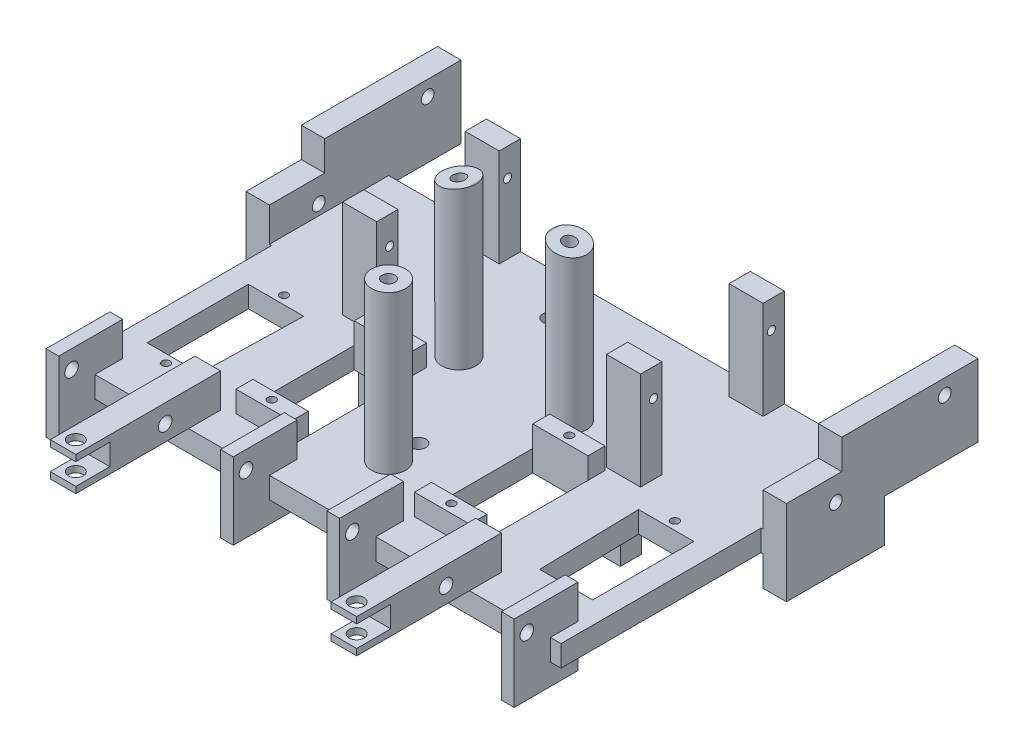
from build123d import *

# Parameters (mm, degrees)
SKETCH_1_W           = 115
SKETCH_1_H           = 75
EXTRUDE_1_DEPTH      = 5
SKETCH_4_W           = 116
SKETCH_4_H           = 28
EXTRUDE_4_DEPTH      = 5
SKETCH_5_W           = 23
SKETCH_5_H           = 20
EXTRUDE_5_DEPTH      = 5.5
SKETCH_6_W           = 32
SKETCH_6_H           = 17
EXTRUDE_6_DEPTH      = 5.5
SKETCH_8_W           = 8
SKETCH_8_H           = 5
EXTRUDE_7_DEPTH      = 23
EXTRUDE_START        = -10
SKETCH_9_W           = 3
SKETCH_9_H           = 15
EXTRUDE_8_DEPTH      = 18
SKETCH_10_W          = 3
SKETCH_10_H          = 15
EXTRUDE_9_DEPTH      = 18
SKETCH_11_W          = 6
SKETCH_11_H          = 34
EXTRUDE_10_DEPTH     = 8
SKETCH_12_R          = 4
EXTRUDE_11_DEPTH     = 37
CUT_EXTRUDE_8_REACH  = 122.453
SKETCH_19_R          = 0.95
SKETCH_25_R          = 4
EXTRUDE_14_DEPTH     = 37
CUT_EXTRUDE_14_DEPTH = 36
SKETCH_28_W          = 6
SKETCH_28_H          = 5
CUT_EXTRUDE_16_DEPTH = 8
SKETCH_29_R          = 1.75
CUT_EXTRUDE_17_DEPTH = 8
SKETCH_30_R          = 1.6
CUT_EXTRUDE_18_DEPTH = 48
SKETCH_31_R          = 1.75
CUT_EXTRUDE_19_DEPTH = 20
SKETCH_35_R          = 1.5
CUT_EXTRUDE_23_DEPTH = 15
SKETCH_36_R          = 0.95
SKETCH_36_W          = 13
SKETCH_36_H          = 23.8
CUT_EXTRUDE_24_DEPTH = 7
SKETCH_37_W          = 6
SKETCH_37_H          = 5
SKETCH_37_W_2        = 5.306431403
EXTRUDE_15_DEPTH     = 13
SKETCH_38_R          = 0.95
CUT_EXTRUDE_25_DEPTH = 13
SKETCH_43_W          = 37.306431403
SKETCH_43_H          = 36.317543969
SKETCH_43_W_2        = 5.306431403
SKETCH_43_H_2        = 5
SKETCH_43_W_3        = 6
CUT_EXTRUDE_28_DEPTH = 2
EXTRUDE_START_2      = 5
SKETCH_41_W          = 13
SKETCH_41_H          = 4
SKETCH_41_R          = 0.95
EXTRUDE_16_DEPTH     = 5
CUT_EXTRUDE_START    = -13
SKETCH_39_R          = 1.5
CUT_EXTRUDE_26_DEPTH = 55


with BuildPart() as part:
    # 草图1 → 凸台-拉伸1 (new body)
    with BuildSketch(Plane(origin=(0, 0, 0), x_dir=(1, 0, 0), z_dir=(0, 1, 0))):
        Rectangle(SKETCH_1_W, SKETCH_1_H)
    extrude(amount=EXTRUDE_1_DEPTH)

    # 草图4 → 凸台-拉伸4 (add)
    with BuildSketch(Plane(origin=(0, 5, 0), x_dir=(1, 0, 0), z_dir=(0, 1, 0))):
        with Locations((0, 23.5)):
            Rectangle(SKETCH_4_W, SKETCH_4_H)
    extrude(amount=-EXTRUDE_4_DEPTH)

    # 草图5 → 凸台-拉伸5 (add)
    with BuildSketch(Plane.ZY.offset(58)):
        with Locations((-21, 3)):
            Rectangle(SKETCH_5_W, SKETCH_5_H)
    extrude_5 = extrude(amount=EXTRUDE_5_DEPTH)

    # 草图6 → 凸台-拉伸6 (add)
    with BuildSketch(Plane.ZY.offset(58)):
        with Locations((-38.5, 11.5)):
            Rectangle(SKETCH_6_W, SKETCH_6_H)
    extrude_6 = extrude(amount=EXTRUDE_6_DEPTH)

    # 草图8 → 凸台-拉伸7 (add)
    with BuildSketch(Plane(origin=(0, 5, 0), x_dir=(1, 0, 0), z_dir=(0, 1, 0))):
        with Locations((-31, 35)):
            Rectangle(SKETCH_8_W, SKETCH_8_H)
        with Locations((-31, 6.2)):
            Rectangle(SKETCH_8_W, SKETCH_8_H)
    extrude_7 = extrude(amount=EXTRUDE_7_DEPTH)

    # 草图9 → 凸台-拉伸8 (add)
    with BuildSketch(Plane(origin=(0, 5, 0), x_dir=(1, 0, 0), z_dir=(0, 1, 0)).offset(EXTRUDE_START)):
        with Locations((-12.5, -38.5)):
            Rectangle(SKETCH_9_W, SKETCH_9_H)
    extrude_8 = extrude(amount=EXTRUDE_8_DEPTH)

    # 草图10 → 凸台-拉伸9 (add)
    with BuildSketch(Plane(origin=(0, 5, 0), x_dir=(1, 0, 0), z_dir=(0, 1, 0)).offset(EXTRUDE_START)):
        with Locations((-53.5, -38.5)):
            Rectangle(SKETCH_10_W, SKETCH_10_H)
    extrude_9 = extrude(amount=EXTRUDE_9_DEPTH)

    # 草图11 → 凸台-拉伸10 (add)
    with BuildSketch(Plane(origin=(0, 5, 0), x_dir=(1, 0, 0), z_dir=(0, 1, 0))):
        with Locations((-33, -47)):
            Rectangle(SKETCH_11_W, SKETCH_11_H)
    extrude_10 = extrude(amount=EXTRUDE_10_DEPTH)

    # 草图12 → 凸台-拉伸11 (add)
    with BuildSketch(Plane(origin=(0, 5, 0), x_dir=(1, 0, 0), z_dir=(0, 1, 0))):
        with Locations(Location((-13, 9, 0), (0, 0, 270))):
            Circle(SKETCH_12_R)
    extrude_11 = extrude(amount=EXTRUDE_11_DEPTH)

    # 草图19 → 切除-拉伸8 (cut, up to next)
    with BuildSketch(Plane.ZY.offset(35), mode=Mode.PRIVATE) as cut_extrude_8_sk1:
        with Locations((-6.75, 21.5)):
            Circle(SKETCH_19_R)
    cut_extrude_8_tool1 = extrude(cut_extrude_8_sk1.sketch, amount=-CUT_EXTRUDE_8_REACH, mode=Mode.PRIVATE) & part.part
    # 草图19 → 切除-拉伸8 (cut, up to next)
    with BuildSketch(Plane.ZY.offset(35), mode=Mode.PRIVATE) as cut_extrude_8_sk2:
        with Locations((-34.45, 21.5)):
            Circle(SKETCH_19_R)
    cut_extrude_8_tool2 = extrude(cut_extrude_8_sk2.sketch, amount=-CUT_EXTRUDE_8_REACH, mode=Mode.PRIVATE) & part.part
    cut_extrude_8_1 = cut_extrude_8_tool1.solids().sort_by_distance((-35, 21.5, -6.75))[0]
    add(cut_extrude_8_1, mode=Mode.SUBTRACT)
    cut_extrude_8_2 = cut_extrude_8_tool2.solids().sort_by_distance((-35, 21.5, -34.45))[0]
    add(cut_extrude_8_2, mode=Mode.SUBTRACT)
    cut_extrude_8 = cut_extrude_8_1 + cut_extrude_8_2  # 切除-拉伸8 as one shape, for the pattern or mirror that repeats it

    # 草图25 → 凸台-拉伸14 (add)
    with BuildSketch(Plane(origin=(0, 5, 0), x_dir=(1, 0, 0), z_dir=(0, 1, 0))):
        with Locations(Location((0, -20.5, 0), (0, 0, 270))):
            Circle(SKETCH_25_R)
    extrude_14 = extrude(amount=EXTRUDE_14_DEPTH)

    # 草图26 → 切除-拉伸14 (cut)
    with BuildSketch(Plane.XY):
        Polygon((-17, 42), (-17, 40.644045518), (-9.31, 42), align=None)
    cut_extrude_14 = extrude(amount=-CUT_EXTRUDE_14_DEPTH, mode=Mode.SUBTRACT)

    # 草图28 → 切除-拉伸16 (cut)
    with BuildSketch(Plane.XY.offset(64)):
        with Locations((-33, 9)):
            Rectangle(SKETCH_28_W, SKETCH_28_H)
    cut_extrude_16 = extrude(amount=-CUT_EXTRUDE_16_DEPTH, mode=Mode.SUBTRACT)

    # 草图29 → 切除-拉伸17 (cut)
    with BuildSketch(Plane(origin=(0, 13, 0), x_dir=(1, 0, 0), z_dir=(0, 1, 0))):
        with Locations(Location((-33, -61, 0), (0, 0, 270))):
            Circle(SKETCH_29_R)
    cut_extrude_17 = extrude(amount=-CUT_EXTRUDE_17_DEPTH, mode=Mode.SUBTRACT)

    # 草图30 → 切除-拉伸18 (cut)
    with BuildSketch(Plane.ZY.offset(55)):
        with Locations((43, 8.75)):
            Circle(SKETCH_30_R)
    cut_extrude_18 = extrude(amount=-CUT_EXTRUDE_18_DEPTH, mode=Mode.SUBTRACT)

    # 草图31 → 切除-拉伸19 (cut)
    with BuildSketch(Plane(origin=(0, 5, 0), x_dir=(1, 0, 0), z_dir=(0, 1, 0))):
        with Locations(Location((0, -13.5, 0), (0, 0, 270))):
            Circle(SKETCH_31_R)
        with Locations(Location((-10, 27.5, 0), (0, 0, 270))):
            Circle(SKETCH_31_R)
        with Locations(Location((10, 27.5, 0), (0, 0, 270))):
            Circle(SKETCH_31_R)
    cut_extrude_19 = extrude(amount=-CUT_EXTRUDE_19_DEPTH, mode=Mode.SUBTRACT)

    # 草图35 → 切除-拉伸23 (cut)
    with BuildSketch(Plane.ZY.offset(63.5)):
        with Locations((-46.688415906, 16.452713274)):
            Circle(SKETCH_35_R)
        with Locations((-21.089366767, 7.437765567)):
            Circle(SKETCH_35_R)
    cut_extrude_23 = extrude(amount=-CUT_EXTRUDE_23_DEPTH, mode=Mode.SUBTRACT)

    # 草图36 → 切除-拉伸24 (cut)
    with BuildSketch(Plane(origin=(0, 5, 0), x_dir=(1, 0, 0), z_dir=(0, 1, 0))):
        with Locations(Location((-21.107931352, 0.851498958, 0), (0, 0, 270))):
            Circle(SKETCH_36_R)
        with Locations(Location((-21.107931352, -26.848501042, 0), (0, 0, 270))):
            Circle(SKETCH_36_R)
        with Locations(Location((-45.971767543, -26.848501042, 0), (0, 0, 270))):
            Circle(SKETCH_36_R)
        with Locations(Location((-45.922700168, 0.851498958, 0), (0, 0, 270))):
            Circle(SKETCH_36_R)
        with Locations((-20.972977651, -12.998501042)):
            Rectangle(SKETCH_36_W, SKETCH_36_H)
        Polygon((-39.336811012, -1.098501042), (-39.899021853, -24.898501042), (-52.336811012, -24.898501042), (-52.336811012, -1.098501042), align=None)
    cut_extrude_24 = extrude(amount=-CUT_EXTRUDE_24_DEPTH, mode=Mode.SUBTRACT)

    # 草图37 → 凸台-拉伸15 (add)
    with BuildSketch(Plane.XZ):
        with Locations((-28.466349778, -34.482456031)):
            Rectangle(SKETCH_37_W, SKETCH_37_H)
        with Locations((-28.11956548, -5.682456031)):
            Rectangle(SKETCH_37_W_2, SKETCH_37_H)
    extrude_15 = extrude(amount=EXTRUDE_15_DEPTH)

    # 草图38 → 切除-拉伸25 (cut)
    with BuildSketch(Plane.ZY.offset(31.466349778)):
        with Locations((-33.932456031, -4.5)):
            Circle(SKETCH_38_R)
        with Locations((-6.232456031, -4.5)):
            Circle(SKETCH_38_R)
    cut_extrude_25 = extrude(amount=-CUT_EXTRUDE_25_DEPTH, mode=Mode.SUBTRACT)

    # 草图43 → 切除-拉伸28 (cut)
    with BuildSketch(Plane.XZ):
        with Locations((-36.11956548, -19.341228016)):
            Rectangle(SKETCH_43_W, SKETCH_43_H)
        with Locations((-28.11956548, -5.682456031)):
            Rectangle(SKETCH_43_W_2, SKETCH_43_H_2, mode=Mode.SUBTRACT)
        with Locations((-28.466349778, -34.482456031)):
            Rectangle(SKETCH_43_W_3, SKETCH_43_H_2, mode=Mode.SUBTRACT)
    cut_extrude_28 = extrude(amount=-CUT_EXTRUDE_28_DEPTH, mode=Mode.SUBTRACT)

    # 草图41 → 凸台-拉伸16 (add)
    # profile 1 of 2: a face of its own
    with BuildSketch(Plane(origin=(0, 5, 0), x_dir=(1, 0, 0), z_dir=(0, 1, 0)).offset(EXTRUDE_START_2)):
        with Locations((-20.972977651, 0.901498958)):
            Rectangle(SKETCH_41_W, SKETCH_41_H)
        with Locations(Location((-21.107931352, 0.851498958, 0), (0, 0, 270))):
            Circle(SKETCH_41_R, mode=Mode.SUBTRACT)
    # profile 2 of 2: a face of its own
    with BuildSketch(Plane(origin=(0, 5, 0), x_dir=(1, 0, 0), z_dir=(0, 1, 0)).offset(EXTRUDE_START_2)):
        with Locations((-20.972977651, -26.898501042)):
            Rectangle(SKETCH_41_W, SKETCH_41_H)
        with Locations(Location((-21.107931352, -26.848501042, 0), (0, 0, 270))):
            Circle(SKETCH_41_R, mode=Mode.SUBTRACT)
    extrude_16 = extrude(amount=-EXTRUDE_16_DEPTH)

    # 草图39 → 切除-拉伸26 (cut)
    with BuildSketch(Plane(origin=(0, 5, 0), x_dir=(1, 0, 0), z_dir=(0, 1, 0)).offset(CUT_EXTRUDE_START)):
        with Locations(Location((-13, 9, 0), (0, 0, 180))):
            Circle(SKETCH_39_R)
        with Locations(Location((0, -20.5, 0), (0, 0, 270))):
            Circle(SKETCH_39_R)
    cut_extrude_26 = extrude(amount=CUT_EXTRUDE_26_DEPTH, mode=Mode.SUBTRACT)

    # 镜向1: 凸台-拉伸5, 凸台-拉伸6, 凸台-拉伸7, 凸台-拉伸8, 凸台-拉伸9, 凸台-拉伸10, 凸台-拉伸11, 切除-拉伸8, 凸台-拉伸14, 切除-拉伸14, 切除-拉伸16, 切除-拉伸17, 切除-拉伸18, 切除-拉伸19, 切除-拉伸23, 切除-拉伸24, 凸台-拉伸15, 切除-拉伸25, 切除-拉伸28, 凸台-拉伸16, 切除-拉伸26 across plane
    add(extrude_5.mirror(Plane(origin=(0, 0, 0), x_dir=(0, 0, 1), z_dir=(1, 0, 0))))
    add(extrude_6.mirror(Plane(origin=(0, 0, 0), x_dir=(0, 0, 1), z_dir=(1, 0, 0))))
    add(extrude_7.mirror(Plane(origin=(0, 0, 0), x_dir=(0, 0, 1), z_dir=(1, 0, 0))))
    add(extrude_8.mirror(Plane(origin=(0, 0, 0), x_dir=(0, 0, 1), z_dir=(1, 0, 0))))
    add(extrude_9.mirror(Plane(origin=(0, 0, 0), x_dir=(0, 0, 1), z_dir=(1, 0, 0))))
    add(extrude_10.mirror(Plane(origin=(0, 0, 0), x_dir=(0, 0, 1), z_dir=(1, 0, 0))))
    add(extrude_11.mirror(Plane(origin=(0, 0, 0), x_dir=(0, 0, 1), z_dir=(1, 0, 0))))
    add(cut_extrude_8.mirror(Plane(origin=(0, 0, 0), x_dir=(0, 0, 1), z_dir=(1, 0, 0))), mode=Mode.SUBTRACT)
    add(extrude_14.mirror(Plane(origin=(0, 0, 0), x_dir=(0, 0, 1), z_dir=(1, 0, 0))))
    add(cut_extrude_14.mirror(Plane(origin=(0, 0, 0), x_dir=(0, 0, 1), z_dir=(1, 0, 0))), mode=Mode.SUBTRACT)
    add(cut_extrude_16.mirror(Plane(origin=(0, 0, 0), x_dir=(0, 0, 1), z_dir=(1, 0, 0))), mode=Mode.SUBTRACT)
    add(cut_extrude_17.mirror(Plane(origin=(0, 0, 0), x_dir=(0, 0, 1), z_dir=(1, 0, 0))), mode=Mode.SUBTRACT)
    add(cut_extrude_18.mirror(Plane(origin=(0, 0, 0), x_dir=(0, 0, 1), z_dir=(1, 0, 0))), mode=Mode.SUBTRACT)
    add(cut_extrude_19.mirror(Plane(origin=(0, 0, 0), x_dir=(0, 0, 1), z_dir=(1, 0, 0))), mode=Mode.SUBTRACT)
    add(cut_extrude_23.mirror(Plane(origin=(0, 0, 0), x_dir=(0, 0, 1), z_dir=(1, 0, 0))), mode=Mode.SUBTRACT)
    add(cut_extrude_24.mirror(Plane(origin=(0, 0, 0), x_dir=(0, 0, 1), z_dir=(1, 0, 0))), mode=Mode.SUBTRACT)
    add(extrude_15.mirror(Plane(origin=(0, 0, 0), x_dir=(0, 0, 1), z_dir=(1, 0, 0))))
    add(cut_extrude_25.mirror(Plane(origin=(0, 0, 0), x_dir=(0, 0, 1), z_dir=(1, 0, 0))), mode=Mode.SUBTRACT)
    add(cut_extrude_28.mirror(Plane(origin=(0, 0, 0), x_dir=(0, 0, 1), z_dir=(1, 0, 0))), mode=Mode.SUBTRACT)
    add(extrude_16.mirror(Plane(origin=(0, 0, 0), x_dir=(0, 0, 1), z_dir=(1, 0, 0))))
    add(cut_extrude_26.mirror(Plane(origin=(0, 0, 0), x_dir=(0, 0, 1), z_dir=(1, 0, 0))), mode=Mode.SUBTRACT)


solid = part.part
